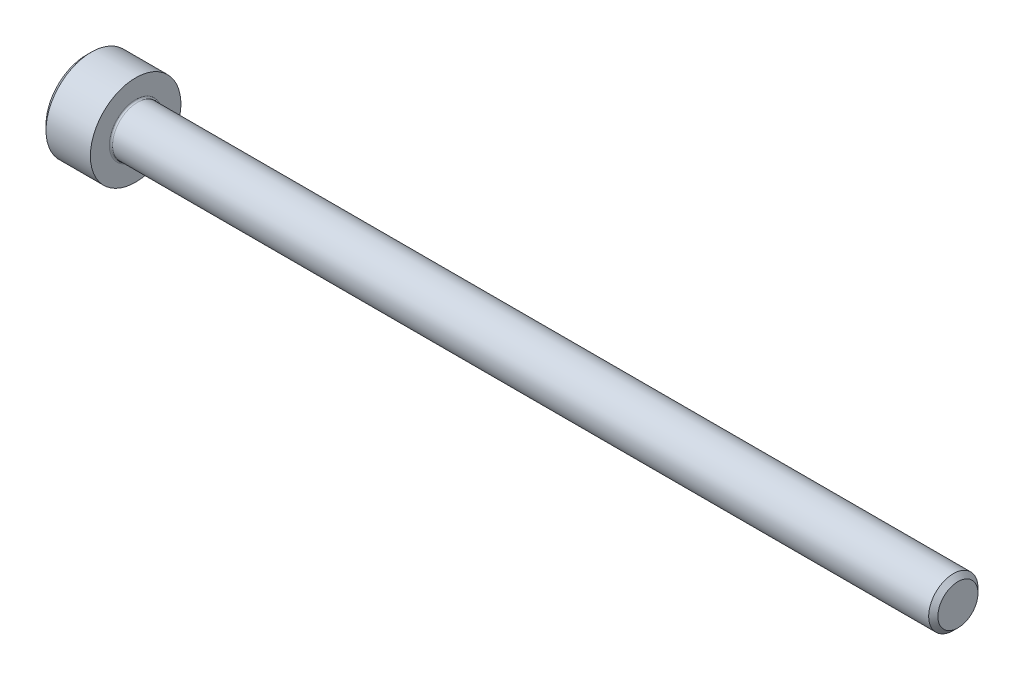
from build123d import *

# Parameters (mm, degrees)
FILLET1_R   = 0.1
HEX_2_DEPTH = 1.3


with BuildPart() as part:
    # BodySke → Base-Revolve (revolve)
    with BuildSketch(Plane.XY, mode=Mode.PRIVATE) as base_revolve_sk:
        Polygon((0, 0), (0, 2.45), (0.3, 2.75), (3, 2.75), (3, 1.5), (52.7195, 1.5), (53, 1.2195), (53, 0), align=None)
    revolve(base_revolve_sk.sketch.rotate(Axis((-31.75, 0, 0), (1, 0, 0)), 90), axis=Axis((-31.75, 0, 0), (1, 0, 0)))

    # Fillet1
    fillet1_edges = [part.edges().sort_by_distance(p)[0] for p in [
        (3, 0, -1.5),
    ]]
    fillet(fillet1_edges, radius=FILLET1_R)

    # Sketch2 → Hex-PreBroach (revolve, cut)
    with BuildSketch(Plane.XY, mode=Mode.PRIVATE) as hex_prebroach_sk:
        Polygon((0, 1.28), (1.3, 1.28), (2.039008345, 0), (0, 0), align=None)
    revolve(hex_prebroach_sk.sketch.rotate(Axis((0, 0, 0), (1, 0, 0)), 90), axis=Axis((0, 0, 0), (1, 0, 0)), mode=Mode.SUBTRACT)

    # Sketch3 → Hex 2 (cut)
    with BuildSketch(Plane(origin=(0, 0, 0), x_dir=(0, 0.500000000000001, 0.866025403784438), z_dir=(-1, 0, 0))):
        Polygon((0.739008345, 1.28), (-0.739008345, 1.28), (-1.478016689, 0), (-0.739008345, -1.28), (0.739008345, -1.28), (1.478016689, 0), align=None)
    extrude(amount=-HEX_2_DEPTH, mode=Mode.SUBTRACT)


solid = part.part
